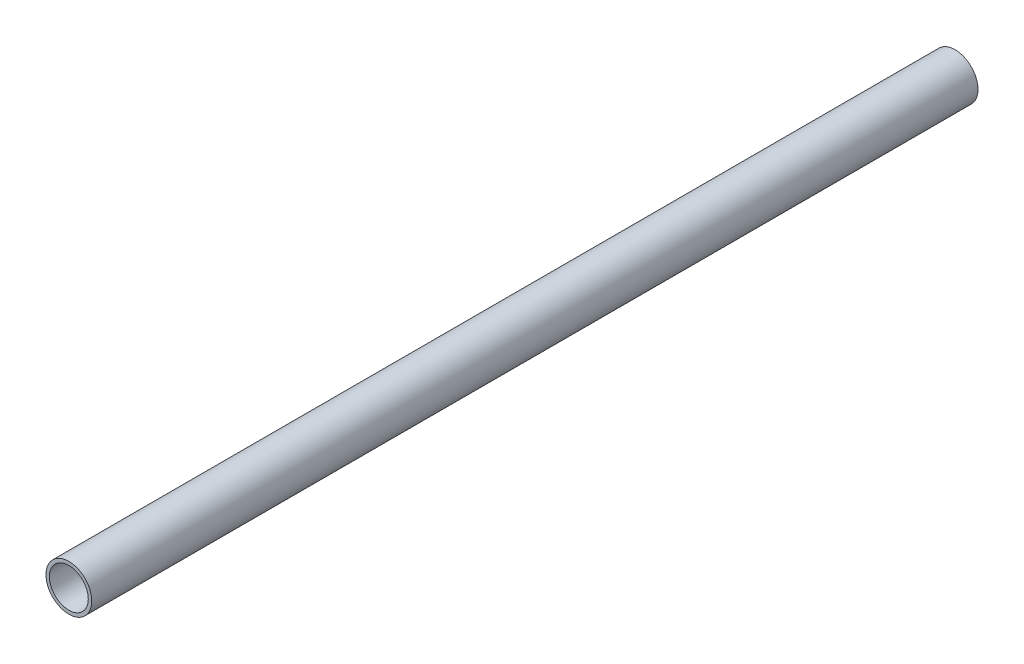
from build123d import *

# Parameters (mm, degrees)
ESQUISSE1_R             = 2.97
BOSS_EXTRU_1_DEPTH      = 115
ESQUISSE2_R             = 2.52
ENL_V_MAT_EXTRU_1_DEPTH = 116.076677915


with BuildPart() as part:
    # Esquisse1 → Boss.-Extru.1 (new body)
    with BuildSketch(Plane.XY):
        Circle(ESQUISSE1_R)
    extrude(amount=BOSS_EXTRU_1_DEPTH)

    # Esquisse2 → Enlèv. mat.-Extru.1 (cut, through all)
    with BuildSketch(Plane.XY.offset(115)):
        Circle(ESQUISSE2_R)
    extrude(amount=-ENL_V_MAT_EXTRU_1_DEPTH, mode=Mode.SUBTRACT)


solid = part.part
